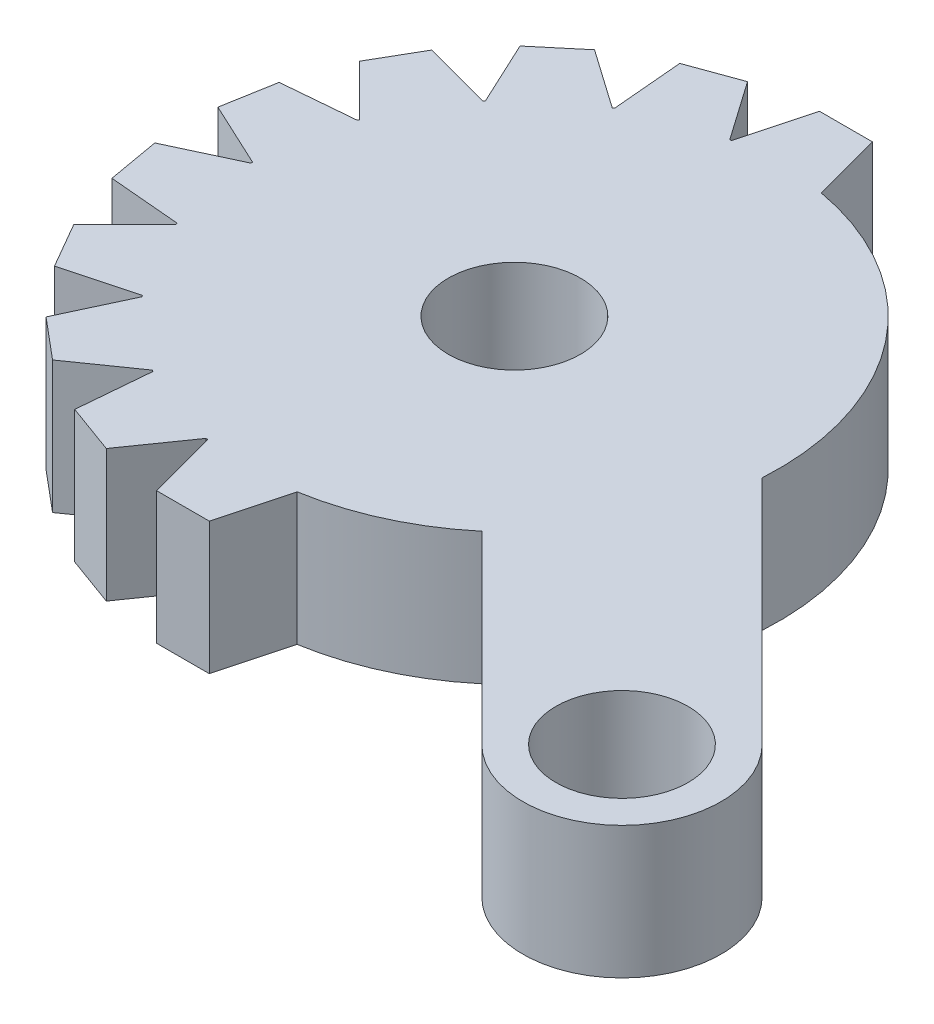
from build123d import *

# Parameters (mm, degrees)
SALIENTE_EXTRUIR1_DEPTH = 10
MATRIZC1_COUNT          = 10
MATRIZC1_ANGLE          = 180
SALIENTE_EXTRUIR5_START = -10
CROQUIS2_R              = 5
SALIENTE_EXTRUIR5_DEPTH = 10


with BuildPart() as part:
    # Croquis1 → Saliente-Extruir1 (new body)
    with BuildSketch(Plane(origin=(0, 0, 0), x_dir=(1, 0, 0), z_dir=(0, 1, 0))):
        with BuildLine():
            Line((0, 5), (0, 20))
            Line((0, 20), (0, 24.969733164))
            Line((0, 24.969733164), (-1.883440248, 24.969733164))
            Line((-1.883440248, 24.969733164), (-3.287991504, 19.727876517))
            ThreePointArc((-3.287991504, 19.727876517), (-19.931853029, -1.649616571), (0, -20))
            Line((0, -20), (0, -5))
            ThreePointArc((0, -5), (-5, 0), (0, 5))
        make_face()
        with BuildLine():
            Line((0, 24.969733164), (0, 20))
            Line((0, 20), (0, 5))
            ThreePointArc((0, 5), (3.535533906, 3.535533906), (5, 0))
            ThreePointArc((5, 0), (3.535533906, -3.535533906), (0, -5))
            Line((0, -5), (0, -20))
            ThreePointArc((0, -20), (19.921238429, -1.773205983), (3.532445918, 19.685574054))
            Line((3.532445918, 19.685574054), (2.116559752, 24.969733164))
            Line((2.116559752, 24.969733164), (0, 24.969733164))
        make_face()
    saliente_extruir1 = extrude(amount=SALIENTE_EXTRUIR1_DEPTH)

    # MatrizC1: Saliente-Extruir1 ×10 about axis
    matrizc1_axis = Axis((0, 0, 0), (0, 1, 0))
    for i in range(1, MATRIZC1_COUNT):
        add(saliente_extruir1.rotate(matrizc1_axis, i * MATRIZC1_ANGLE / (MATRIZC1_COUNT - 1)))

    # Croquis2 → Saliente-Extruir5 (add)
    with BuildSketch(Plane.XZ.offset(SALIENTE_EXTRUIR5_START)):
        with BuildLine():
            Line((26.827116941, 29.295976121), (12.853727975, 15.322587155))
            ThreePointArc((12.853727975, 15.322587155), (17.859540741, 9.002044462), (19.962846781, 1.218502525))
            Line((19.962846781, 1.218502525), (37.433718659, 18.689374403))
            ThreePointArc((37.433718659, 18.689374403), (37.433718659, 29.295976121), (26.827116941, 29.295976121))
        make_face()
        with Locations(Location((32.1304178, 23.992675262, 0), (0, 0, 270))):
            Circle(CROQUIS2_R, mode=Mode.SUBTRACT)
    extrude(amount=SALIENTE_EXTRUIR5_DEPTH)


solid = part.part
